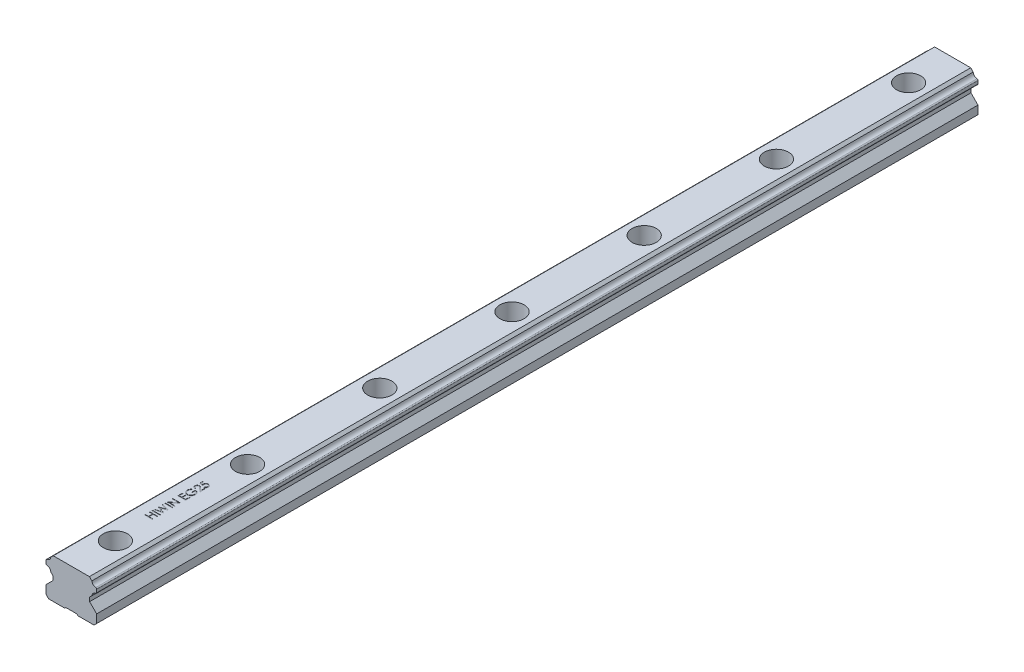
from build123d import *

# Parameters (mm, degrees)
EXTRUDE_1_DEPTH              = 400
HOLE_WIZARD_M6_1_D           = 7
HOLE_WIZARD_M6_1_CBORE_D     = 11
HOLE_WIZARD_M6_1_CBORE_DEPTH = 9
PATTERN_LINEAR_1_COUNT       = 7
PATTERN_LINEAR_1_PITCH       = 60
SKETCH_6_W                   = 3.5
SKETCH_6_H                   = 0.314102564
CUT_EXTRUDE_1_DEPTH          = 0.1


with BuildPart() as part:
    # 草图1 → 凸台-拉伸1 (new body)
    with BuildSketch(Plane.XY):
        with BuildLine():
            Line((-8.3, 10), (-8.3, 8.2))
            Line((-8.3, 8.2), (-11.5, 5))
            Line((-11.5, 5), (-11.5, 1.2))
            Line((-11.5, 1.2), (-10.3, 0))
            Line((-10.3, 0), (-3, 0))
            Line((-3, 0), (-2.5, 0.5))
            Line((-2.5, 0.5), (2.5, 0.5))
            Line((2.5, 0.5), (3, 0))
            Line((3, 0), (10.3, 0))
            Line((10.3, 0), (11.5, 1.2))
            Line((11.5, 1.2), (11.5, 5))
            Line((11.5, 5), (8.3, 8.2))
            Line((8.3, 8.2), (8.3, 10))
            Line((8.3, 10), (9.304973284, 11.004973284))
            ThreePointArc((9.304973284, 11.004973284), (9.85104643, 12.242616368), (11.06, 12.84956575))
            ThreePointArc((11.06, 12.84956575), (11.374165739, 13.014290217), (11.5, 13.345952696))
            Line((11.5, 13.345952696), (11.5, 14.635365271))
            ThreePointArc((11.5, 14.635365271), (11.374165739, 14.96702775), (11.06, 15.131752214))
            ThreePointArc((11.06, 15.131752214), (9.884069401, 15.704805561), (9.313874944, 16.882125056))
            Line((9.313874944, 16.882125056), (8.196000002, 17.999999998))
            Line((8.196000002, 17.999999998), (-8.196000002, 17.999999998))
            Line((-8.196000002, 17.999999998), (-9.313874944, 16.882125056))
            ThreePointArc((-9.313874944, 16.882125056), (-9.884069402, 15.704805561), (-11.060000002, 15.131752215))
            ThreePointArc((-11.060000002, 15.131752215), (-11.374165741, 14.967027748), (-11.500000002, 14.635365269))
            Line((-11.500000002, 14.635365269), (-11.500000002, 13.345952694))
            ThreePointArc((-11.500000002, 13.345952694), (-11.374165741, 13.014290214), (-11.060000001, 12.849565751))
            ThreePointArc((-11.060000001, 12.849565751), (-9.851046431, 12.242616369), (-9.304973284, 11.004973284))
            Line((-9.304973284, 11.004973284), (-8.3, 10))
        make_face()
    extrude(amount=-EXTRUDE_1_DEPTH)

    # M6 六角凹头螺钉的柱形沉头孔1 (through all)
    with Locations(Plane(origin=(0.320241727, 17.999999998, -29.229672342), x_dir=(-1, 0, 0), z_dir=(0, 1, 0))):
        with Locations((0.320241727, 9.229672342)):
            hole_wizard_m6_1 = CounterBoreHole(HOLE_WIZARD_M6_1_D / 2, HOLE_WIZARD_M6_1_CBORE_D / 2, HOLE_WIZARD_M6_1_CBORE_DEPTH)

    # 阵列(线性)1: M6 六角凹头螺钉的柱形沉头孔1 ×7
    with Locations(*[(0, 0, -i * PATTERN_LINEAR_1_PITCH) for i in range(1, PATTERN_LINEAR_1_COUNT)]):
        add(hole_wizard_m6_1, mode=Mode.SUBTRACT)

    # 草图6 → 切除-拉伸1 (cut)
    with BuildSketch(Plane(origin=(0, 17.999999998, 0), x_dir=(1, 0, 0), z_dir=(0, 1, 0))):
        Polygon((-3.5, 36.762820513), (-3.5, 37.076923077), (-2.064102564, 37.076923077), (-2.064102564, 38.871794872), (-3.5, 38.871794872), (-3.5, 39.185897436), (0, 39.185897436), (0, 38.871794872), (-1.705128205, 38.871794872), (-1.705128205, 37.076923077), (0, 37.076923077), (0, 36.762820513), align=None)
        with Locations((-1.75, 40.240384615)):
            Rectangle(SKETCH_6_W, SKETCH_6_H)
        Polygon((-3.5, 40.935897436), (-3.5, 41.260516827), (-0.933193109, 41.945512821), (-3.5, 42.964242788), (-3.5, 43.009815705), (-0.950721154, 44.009615385), (-3.5, 44.698116987), (-3.5, 45.019230769), (0, 44.075520833), (0, 44.030649038), (-2.676883013, 42.977564103), (0, 41.911858974), (0, 41.866987179), align=None)
        with Locations((-1.75, 45.983974359)):
            Rectangle(SKETCH_6_W, SKETCH_6_H)
        Polygon((0, 46.903846154), (-3.5, 46.903846154), (-3.5, 46.969751603), (-0.745292468, 49.282051282), (-3.5, 49.282051282), (-3.5, 49.596153846), (0, 49.596153846), (0, 49.524639423), (-2.748397436, 47.217948718), (0, 47.217948718), align=None)
        Polygon((-3.5, 51.83974359), (-3.5, 53.814102564), (-3.141025641, 53.814102564), (-3.141025641, 52.153846154), (-2.064102564, 52.153846154), (-2.064102564, 53.814102564), (-1.705128205, 53.814102564), (-1.705128205, 52.153846154), (-0.358974359, 52.153846154), (-0.358974359, 53.814102564), (0, 53.814102564), (0, 51.83974359), align=None)
        with BuildLine():
            Line((-2.902644231, 57.717948718), (-2.647435897, 57.448717949))
            add(Edge.make_bspline(
                [(-2.647435897, 57.448717949), (-2.69328212, 57.400008868), (-2.783881335, 57.303752203), (-2.901244074, 57.146552261), (-3.002777003, 56.983196408), (-3.084772592, 56.813420508), (-3.149094254, 56.641676508), (-3.195850217, 56.470917554), (-3.225460377, 56.302249256), (-3.229016796, 56.190084954), (-3.230769231, 56.134815705)],
                knots=[0, 0, 0, 0, 1.089067066, 2.152164705, 3.18986567, 4.218445106, 5.218487318, 6.173592265, 7.100032889, 8, 8, 8, 8], degree=3))
            add(Edge.make_bspline(
                [(-3.230769231, 56.134815705), (-3.230355625, 56.100901005), (-3.229529486, 56.033159565), (-3.218985271, 55.932537621), (-3.203820407, 55.832970983), (-3.181878529, 55.734647609), (-3.15406947, 55.637376321), (-3.119284004, 55.541495434), (-3.078728771, 55.446826062), (-3.031866252, 55.354260043), (-2.980386575, 55.26451931), (-2.923337414, 55.179763314), (-2.862550889, 55.099446852), (-2.796491613, 55.025097645), (-2.725807311, 54.956221131), (-2.651770944, 54.89155043), (-2.572926872, 54.832290852), (-2.489599321, 54.779505212), (-2.403726867, 54.731837618), (-2.316037795, 54.690645418), (-2.227346143, 54.654835464), (-2.136984078, 54.627561503), (-2.045883197, 54.604460629), (-1.953566086, 54.588379393), (-1.859791669, 54.579283076), (-1.796993971, 54.577712585), (-1.765424679, 54.576923077)],
                knots=[0, 0, 0, 0, 1.028150113, 2.053633673, 3.06513288, 4.081487945, 5.106702018, 6.131327874, 7.172780699, 8.228344599, 9.276313556, 10.308389736, 11.324843658, 12.329040066, 13.321460474, 14.316307835, 15.308626991, 16.309440696, 17.305625405, 18.28535951, 19.246194545, 20.203493668, 21.145557131, 22.095268976, 23.042464743, 24, 24, 24, 24], degree=3))
            add(Edge.make_bspline(
                [(-1.765424679, 54.576923077), (-1.733154018, 54.577679272), (-1.668700816, 54.579189598), (-1.572504414, 54.588842795), (-1.477747832, 54.606798005), (-1.384282029, 54.630609755), (-1.291920993, 54.66088243), (-1.20076111, 54.698074944), (-1.110811241, 54.742381076), (-1.022964324, 54.793552345), (-0.937464192, 54.850061813), (-0.856251713, 54.912212997), (-0.780271995, 54.980110534), (-0.708415252, 55.052509477), (-0.641134974, 55.130069473), (-0.579242122, 55.213543005), (-0.521779643, 55.301761597), (-0.469378807, 55.394764386), (-0.42257144, 55.491568366), (-0.38094723, 55.590824797), (-0.346667976, 55.692852699), (-0.31872985, 55.797115365), (-0.295829559, 55.903488643), (-0.281097077, 56.012512444), (-0.270406246, 56.123385153), (-0.269624576, 56.198123785), (-0.269230769, 56.235777244)],
                knots=[0, 0, 0, 0, 0.935915162, 1.869274651, 2.799799983, 3.730201895, 4.664668062, 5.616159355, 6.583070886, 7.570012957, 8.562524459, 9.553461134, 10.53281078, 11.515274572, 12.509912756, 13.507571325, 14.526460018, 15.561318395, 16.601025881, 17.643204557, 18.680545676, 19.719612342, 20.772381578, 21.833430283, 22.908478249, 24, 24, 24, 24], degree=3))
            add(Edge.make_bspline(
                [(-0.269230769, 56.235777244), (-0.270178952, 56.281155776), (-0.272040863, 56.370263896), (-0.286546735, 56.501247716), (-0.309173205, 56.627060334), (-0.342412256, 56.747292172), (-0.384484705, 56.862379567), (-0.436513285, 56.971898055), (-0.497950569, 57.076150049), (-0.567552463, 57.174684309), (-0.645100929, 57.26515833), (-0.728035637, 57.347500409), (-0.817431068, 57.418879031), (-0.911954918, 57.481426348), (-1.012511326, 57.533123592), (-1.118540888, 57.57556947), (-1.230109213, 57.608101926), (-1.307200733, 57.621457015), (-1.346153846, 57.628205128)],
                knots=[0, 0, 0, 0, 1.130199668, 2.219330667, 3.279027493, 4.311506524, 5.322739849, 6.327972234, 7.327472899, 8.33386792, 9.329086447, 10.29244429, 11.240784345, 12.174119183, 13.111530729, 14.052100829, 15.015757696, 16, 16, 16, 16], degree=3))
            Line((-1.346153846, 57.628205128), (-1.346153846, 56.461538462))
            Line((-1.346153846, 56.461538462), (-1.705128205, 56.461538462))
            Line((-1.705128205, 56.461538462), (-1.705128205, 57.942307692))
            add(Edge.make_bspline(
                [(-1.705128205, 57.942307692), (-1.638220716, 57.940601844), (-1.507270675, 57.937263191), (-1.316300404, 57.913844275), (-1.13592871, 57.876027763), (-0.965965639, 57.824367451), (-0.806652046, 57.75749217), (-0.65782618, 57.676119642), (-0.520449499, 57.578947521), (-0.393400495, 57.469437079), (-0.280071283, 57.346537122), (-0.180465345, 57.213568502), (-0.09656273, 57.070311533), (-0.028302067, 56.916901726), (0.024971927, 56.753841292), (0.062743504, 56.580752913), (0.085373467, 56.397871312), (0.088264847, 56.272534635), (0.08974359, 56.208433494)],
                knots=[0, 0, 0, 0, 1.140356446, 2.231883559, 3.274166699, 4.278491846, 5.25512956, 6.21435461, 7.1637429, 8.11826594, 9.068280886, 10.0076534, 10.945064095, 11.891975133, 12.864533718, 13.863980011, 14.907571808, 16, 16, 16, 16], degree=3))
            add(Edge.make_bspline(
                [(0.08974359, 56.208433494), (0.089174469, 56.168923358), (0.088051978, 56.090996637), (0.080074631, 55.975905709), (0.067794054, 55.863988089), (0.049248931, 55.75526008), (0.026534277, 55.649321738), (-0.002552442, 55.546702153), (-0.036221141, 55.447010411), (-0.074516815, 55.350092425), (-0.118888472, 55.256827878), (-0.168198111, 55.166801361), (-0.222191472, 55.079515236), (-0.281802318, 54.995564071), (-0.346584778, 54.914510449), (-0.416668697, 54.836877005), (-0.491839816, 54.762229127), (-0.545218826, 54.715468664), (-0.572115385, 54.691907051)],
                knots=[0, 0, 0, 0, 1.107784379, 2.184907829, 3.233506516, 4.263428166, 5.276301166, 6.270063455, 7.25232949, 8.225834625, 9.190232166, 10.146266622, 11.1027726, 12.066435141, 13.031522626, 14.010570082, 14.99756817, 16, 16, 16, 16], degree=3))
            add(Edge.make_bspline(
                [(-0.572115385, 54.691907051), (-0.614786038, 54.657721119), (-0.699419055, 54.589916707), (-0.835018999, 54.50263855), (-0.975420859, 54.428237147), (-1.121015488, 54.367869325), (-1.271666701, 54.320731239), (-1.427181992, 54.286924986), (-1.587761622, 54.267117697), (-1.696426887, 54.264264159), (-1.751402244, 54.262820513)],
                knots=[0, 0, 0, 0, 1.023165419, 2.029347347, 3.013907458, 3.994755782, 4.975994455, 5.96558838, 6.970761222, 8, 8, 8, 8], degree=3))
            add(Edge.make_bspline(
                [(-1.751402244, 54.262820513), (-1.792568496, 54.263352751), (-1.874377804, 54.264410462), (-1.99583511, 54.27723598), (-2.115135808, 54.295637392), (-2.232182344, 54.322684468), (-2.347053012, 54.356780654), (-2.45980069, 54.399334435), (-2.570493643, 54.448878213), (-2.67836343, 54.50646793), (-2.782003044, 54.570536667), (-2.880905313, 54.640144323), (-2.973467332, 54.715828008), (-3.059903521, 54.797808103), (-3.141494975, 54.884432033), (-3.216537375, 54.977518334), (-3.286205011, 55.07565667), (-3.349159221, 55.17960781), (-3.405727075, 55.287731441), (-3.455315154, 55.399792527), (-3.496298775, 55.515750345), (-3.531072472, 55.634737902), (-3.556787635, 55.757655381), (-3.575436374, 55.883610924), (-3.588196976, 56.013261034), (-3.589223231, 56.100897064), (-3.58974359, 56.145332532)],
                knots=[0, 0, 0, 0, 1.00895651, 2.005089799, 2.991467152, 3.967318338, 4.948153826, 5.927364234, 6.919980553, 7.91976625, 8.923240147, 9.905815003, 10.88314567, 11.851989312, 12.825009789, 13.798721852, 14.781296708, 15.773896486, 16.776076962, 17.771600213, 18.775744723, 19.78957137, 20.808953803, 21.851964491, 22.910847925, 24, 24, 24, 24], degree=3))
            add(Edge.make_bspline(
                [(-3.58974359, 56.145332532), (-3.589164098, 56.181570776), (-3.588015034, 56.253426954), (-3.580050386, 56.360352687), (-3.567426505, 56.465625701), (-3.550199718, 56.569402091), (-3.526736028, 56.671328458), (-3.498657743, 56.771695163), (-3.46596592, 56.870647699), (-3.426977074, 56.967875948), (-3.382723449, 57.064033664), (-3.332910027, 57.159655505), (-3.276685022, 57.254414751), (-3.213881487, 57.348475732), (-3.145578069, 57.44243159), (-3.069821245, 57.534796233), (-2.989598489, 57.627799177), (-2.931916305, 57.687600991), (-2.902644231, 57.717948718)],
                knots=[0, 0, 0, 0, 0.985871117, 1.954866573, 2.915460327, 3.869826059, 4.81536089, 5.759505086, 6.70452669, 7.649098992, 8.607881297, 9.583363685, 10.581137262, 11.603961102, 12.659522466, 13.73993555, 14.853081303, 16, 16, 16, 16], degree=3))
        make_face()
        with BuildLine():
            Line((-2.423076923, 58.794871795), (-2.423076923, 58.480769231))
            add(Edge.make_bspline(
                [(-2.423076923, 58.480769231), (-2.464747811, 58.482816384), (-2.546588325, 58.486836938), (-2.665912232, 58.505665227), (-2.779967031, 58.532606104), (-2.887836945, 58.570697558), (-2.990475752, 58.618003836), (-3.087475767, 58.674733863), (-3.178466956, 58.741927714), (-3.262605799, 58.818134448), (-3.33979337, 58.900903087), (-3.406448613, 58.990209027), (-3.462766284, 59.084054054), (-3.509847526, 59.182153453), (-3.545187372, 59.285614016), (-3.571409012, 59.393496874), (-3.587185357, 59.506276011), (-3.588881143, 59.583116033), (-3.58974359, 59.622195513)],
                knots=[0, 0, 0, 0, 1.10065271, 2.161652631, 3.183658789, 4.190468796, 5.17591951, 6.163126047, 7.15150782, 8.156236427, 9.156009102, 10.134482811, 11.092018607, 12.041330605, 13.001268258, 13.972401359, 14.968799086, 16, 16, 16, 16], degree=3))
            add(Edge.make_bspline(
                [(-3.58974359, 59.622195513), (-3.588852424, 59.660576288), (-3.587101316, 59.735993139), (-3.571837144, 59.846016947), (-3.54844616, 59.951006046), (-3.513784407, 60.049770596), (-3.47029149, 60.1433242), (-3.416202348, 60.230508508), (-3.354076299, 60.313431728), (-3.280795578, 60.388024133), (-3.202604863, 60.456546255), (-3.119097837, 60.515608182), (-3.032749001, 60.566472778), (-2.942883845, 60.608103861), (-2.849209723, 60.639662073), (-2.752624723, 60.663043684), (-2.652014188, 60.676409876), (-2.583905673, 60.678449978), (-2.549278846, 60.679487179)],
                knots=[0, 0, 0, 0, 1.111674182, 2.184400057, 3.212814286, 4.223731311, 5.211378316, 6.196328225, 7.191884489, 8.207283132, 9.220262353, 10.201199469, 11.166417575, 12.120932471, 13.06540007, 14.026332106, 14.996573967, 16, 16, 16, 16], degree=3))
            add(Edge.make_bspline(
                [(-2.549278846, 60.679487179), (-2.500531033, 60.67779389), (-2.403890861, 60.674437026), (-2.26187569, 60.645723039), (-2.124283442, 60.600875044), (-2.013542366, 60.546882472), (-1.924317319, 60.492399318), (-1.850817554, 60.443351191), (-1.771698892, 60.3856057), (-1.686641103, 60.319656196), (-1.59675809, 60.244366935), (-1.500215998, 60.161693923), (-1.398799957, 60.0695021), (-1.329486308, 60.004853468), (-1.293569712, 59.971354167)],
                knots=[0, 0, 0, 0, 1.184416499, 2.348048165, 3.509039915, 4.696071444, 5.333504901, 6.05069495, 6.844171097, 7.714965912, 8.667477798, 9.695072654, 10.805644396, 12, 12, 12, 12], degree=3))
            Line((-1.293569712, 59.971354167), (-0.358974359, 59.095653045))
            Line((-0.358974359, 59.095653045), (-0.358974359, 60.724358974))
            Line((-0.358974359, 60.724358974), (0, 60.724358974))
            Line((0, 60.724358974), (0, 58.346153846))
            Line((0, 58.346153846), (-1.448517628, 59.703525641))
            add(Edge.make_bspline(
                [(-1.448517628, 59.703525641), (-1.483015935, 59.736573528), (-1.549280121, 59.800051755), (-1.646023081, 59.889834332), (-1.735772622, 59.97047332), (-1.818359171, 60.042490713), (-1.894990738, 60.104324218), (-1.963185442, 60.15919645), (-2.025939892, 60.203162041), (-2.098680506, 60.250877437), (-2.187492823, 60.297091418), (-2.296026513, 60.336803774), (-2.407753765, 60.361018623), (-2.483255802, 60.363923458), (-2.521233974, 60.365384615)],
                knots=[0, 0, 0, 0, 1.329631726, 2.553950428, 3.673215718, 4.687767853, 5.603093632, 6.413772471, 7.123043292, 7.734684054, 8.834405432, 9.900288307, 10.943827018, 12, 12, 12, 12], degree=3))
            add(Edge.make_bspline(
                [(-2.521233974, 60.365384615), (-2.545115373, 60.364748873), (-2.592181023, 60.363495947), (-2.661186782, 60.35243825), (-2.727751596, 60.335727744), (-2.792080215, 60.311782485), (-2.853525867, 60.280175745), (-2.912163347, 60.241702365), (-2.968852313, 60.197312302), (-3.022005611, 60.145961033), (-3.070686816, 60.089549513), (-3.113810902, 60.029955263), (-3.149850012, 59.966905159), (-3.179393509, 59.900665037), (-3.202568891, 59.831419567), (-3.21862747, 59.759034822), (-3.228709954, 59.683710806), (-3.230074126, 59.63227731), (-3.230769231, 59.606069712)],
                knots=[0, 0, 0, 0, 0.991446411, 1.95395049, 2.89581595, 3.838931463, 4.798493298, 5.75982156, 6.748411868, 7.785213223, 8.824556874, 9.840280684, 10.836137867, 11.835679398, 12.848801643, 13.863922112, 14.911575587, 16, 16, 16, 16], degree=3))
            add(Edge.make_bspline(
                [(-3.230769231, 59.606069712), (-3.230082413, 59.578692009), (-3.228733615, 59.524926721), (-3.218517149, 59.446154931), (-3.203028983, 59.370491191), (-3.178430394, 59.299064471), (-3.149365939, 59.230328072), (-3.11244268, 59.165749406), (-3.069537034, 59.104256271), (-3.019786187, 59.046860109), (-2.963887514, 58.994439145), (-2.902283318, 58.947732824), (-2.835417099, 58.907191743), (-2.76356329, 58.871770625), (-2.686006495, 58.843018271), (-2.603039645, 58.821044175), (-2.515018024, 58.803657593), (-2.454232973, 58.797849035), (-2.423076923, 58.794871795)],
                knots=[0, 0, 0, 0, 1.030878251, 2.024474673, 2.987898669, 3.934362936, 4.864849709, 5.795128259, 6.730474222, 7.685293701, 8.650606017, 9.611896181, 10.591709709, 11.591680886, 12.625074257, 13.701333388, 14.821793024, 16, 16, 16, 16], degree=3))
        make_face()
        with BuildLine():
            Line((-3.5, 63.237179487), (-3.141025641, 63.237179487))
            Line((-3.141025641, 63.237179487), (-3.141025641, 62.046674679))
            Line((-3.141025641, 62.046674679), (-2.220452724, 61.858072917))
            add(Edge.make_bspline(
                [(-2.220452724, 61.858072917), (-2.230682996, 61.895128791), (-2.25050253, 61.966918687), (-2.2725083, 62.072878548), (-2.285773744, 62.173470751), (-2.287585055, 62.238746122), (-2.288461538, 62.270332532)],
                knots=[0, 0, 0, 0, 1.100273476, 2.13160584, 3.095893838, 4, 4, 4, 4], degree=3))
            add(Edge.make_bspline(
                [(-2.288461538, 62.270332532), (-2.28764354, 62.309423446), (-2.28603515, 62.38628595), (-2.269673986, 62.498570255), (-2.245976174, 62.606297591), (-2.209465207, 62.707877373), (-2.164878805, 62.804916696), (-2.108721258, 62.895749027), (-2.04315746, 62.981649201), (-1.968525078, 63.06202352), (-1.885534459, 63.134596519), (-1.795933934, 63.197660062), (-1.701678739, 63.252702837), (-1.600559725, 63.295631262), (-1.494484031, 63.330665044), (-1.382227183, 63.353766408), (-1.264785773, 63.369197118), (-1.18448027, 63.370917558), (-1.143529647, 63.371794872)],
                knots=[0, 0, 0, 0, 1.052805225, 2.070078116, 3.052532748, 4.020689046, 4.973125432, 5.925915817, 6.89216474, 7.881560752, 8.877013184, 9.857446635, 10.830895175, 11.812622661, 12.812548702, 13.836681939, 14.896847428, 16, 16, 16, 16], degree=3))
            add(Edge.make_bspline(
                [(-1.143529647, 63.371794872), (-1.115007605, 63.371129197), (-1.058348972, 63.369806845), (-0.974202158, 63.363097041), (-0.891849045, 63.350128648), (-0.811440613, 63.332928531), (-0.732901554, 63.309967224), (-0.65579213, 63.283109802), (-0.580956685, 63.249727804), (-0.508064701, 63.21272013), (-0.437950402, 63.171741106), (-0.372294905, 63.125661103), (-0.309599937, 63.077781326), (-0.251727444, 63.02546383), (-0.198452948, 62.969303437), (-0.149513072, 62.909612628), (-0.104029493, 62.846932808), (-0.063861909, 62.780276778), (-0.026898788, 62.711134508), (0.003424705, 62.638506234), (0.030535245, 62.564045549), (0.05214477, 62.486680669), (0.069077325, 62.406586858), (0.080577925, 62.323632082), (0.088954363, 62.238251412), (0.08947872, 62.180376399), (0.08974359, 62.151141827)],
                knots=[0, 0, 0, 0, 1.056393913, 2.098511576, 3.122979385, 4.141471433, 5.141222888, 6.151259816, 7.162667642, 8.172852865, 9.177685681, 10.166741883, 11.141342384, 12.097242845, 13.052202613, 14.005160326, 14.953864445, 15.917140761, 16.884916217, 17.854238259, 18.828761908, 19.81781811, 20.826036654, 21.857789401, 22.917898972, 24, 24, 24, 24], degree=3))
            add(Edge.make_bspline(
                [(0.08974359, 62.151141827), (0.089050894, 62.116268535), (0.087688097, 62.047659454), (0.073496095, 61.947126211), (0.053035464, 61.850457897), (0.022721931, 61.758068818), (-0.016971483, 61.670344289), (-0.064133263, 61.586028116), (-0.12027864, 61.506165359), (-0.184894072, 61.431302018), (-0.255892818, 61.362486012), (-0.332202561, 61.300083151), (-0.413920487, 61.245219514), (-0.500780871, 61.197696086), (-0.592629648, 61.157210456), (-0.689749822, 61.12539205), (-0.791650601, 61.099714631), (-0.861804004, 61.088851082), (-0.897435897, 61.083333333)],
                knots=[0, 0, 0, 0, 1.046872515, 2.059598001, 3.044168548, 4.012104806, 4.973680974, 5.932408326, 6.910122221, 7.900780896, 8.89867654, 9.876692837, 10.858029398, 11.85084981, 12.847361615, 13.868568023, 14.917415949, 16, 16, 16, 16], degree=3))
            Line((-0.897435897, 61.083333333), (-0.897435897, 61.397435897))
            add(Edge.make_bspline(
                [(-0.897435897, 61.397435897), (-0.86405597, 61.40515962), (-0.799897896, 61.420005043), (-0.709812799, 61.452675135), (-0.62950762, 61.4922321), (-0.558491359, 61.540366037), (-0.495464081, 61.596159433), (-0.43989307, 61.661016372), (-0.389697273, 61.733315452), (-0.347784769, 61.813697831), (-0.312479137, 61.898665893), (-0.287283878, 61.987088992), (-0.272032646, 62.077694545), (-0.270168243, 62.138697165), (-0.269230769, 62.169370994)],
                knots=[0, 0, 0, 0, 1.13623081, 2.183898708, 3.172478118, 4.09966615, 5.022692284, 5.957376522, 6.927682873, 7.937366477, 8.960015386, 9.976409503, 10.982481913, 12, 12, 12, 12], degree=3))
            add(Edge.make_bspline(
                [(-0.269230769, 62.169370994), (-0.270058415, 62.199326897), (-0.271688055, 62.258310315), (-0.284028564, 62.345158154), (-0.303533592, 62.428761408), (-0.33085902, 62.509268484), (-0.367008958, 62.586283786), (-0.411417074, 62.659698422), (-0.462975425, 62.730558248), (-0.521904738, 62.796998341), (-0.586881759, 62.857834583), (-0.656357238, 62.911591543), (-0.730474586, 62.956368236), (-0.807947606, 62.994102404), (-0.889626199, 63.022755687), (-0.975127364, 63.043196672), (-1.064662347, 63.05519973), (-1.125731657, 63.05685091), (-1.156850962, 63.057692308)],
                knots=[0, 0, 0, 0, 1.027268864, 2.022700798, 3.002744649, 3.968653148, 4.933396556, 5.915045722, 6.907600446, 7.935526002, 8.956456544, 9.95700807, 10.942805781, 11.92166854, 12.907987664, 13.905483474, 14.932689774, 16, 16, 16, 16], degree=3))
            add(Edge.make_bspline(
                [(-1.156850962, 63.057692308), (-1.184930032, 63.057053836), (-1.239659043, 63.055809387), (-1.320009695, 63.045036283), (-1.396158478, 63.027039982), (-1.468436727, 63.001416905), (-1.536613353, 62.969438486), (-1.600538112, 62.929288612), (-1.660812066, 62.882676899), (-1.715884112, 62.82825878), (-1.766793088, 62.769063131), (-1.810034281, 62.703569507), (-1.846807397, 62.633526342), (-1.876936465, 62.558803838), (-1.900936575, 62.479309952), (-1.917523378, 62.395001869), (-1.92744867, 62.305860374), (-1.928795087, 62.24488473), (-1.929487179, 62.213541667)],
                knots=[0, 0, 0, 0, 1.045723156, 2.038222538, 3.013889863, 3.95567481, 4.890389958, 5.81331128, 6.76251276, 7.723027653, 8.692928204, 9.666105983, 10.639751036, 11.635719707, 12.66315958, 13.728667616, 14.832476222, 16, 16, 16, 16], degree=3))
            add(Edge.make_bspline(
                [(-1.929487179, 62.213541667), (-1.928906588, 62.186412738), (-1.927707815, 62.130398383), (-1.918881318, 62.044475556), (-1.904642024, 61.954183833), (-1.885055776, 61.859869337), (-1.859424699, 61.761248829), (-1.828710199, 61.658530428), (-1.7919882, 61.551498162), (-1.764255986, 61.479380437), (-1.75, 61.442307692)],
                knots=[0, 0, 0, 0, 0.817624296, 1.688186739, 2.600797293, 3.572016777, 4.590301741, 5.671205678, 6.80286297, 8, 8, 8, 8], degree=3))
            Line((-1.75, 61.442307692), (-3.5, 61.801282051))
            Line((-3.5, 61.801282051), (-3.5, 63.237179487))
        make_face()
    extrude(amount=-CUT_EXTRUDE_1_DEPTH, mode=Mode.SUBTRACT)


solid = part.part
